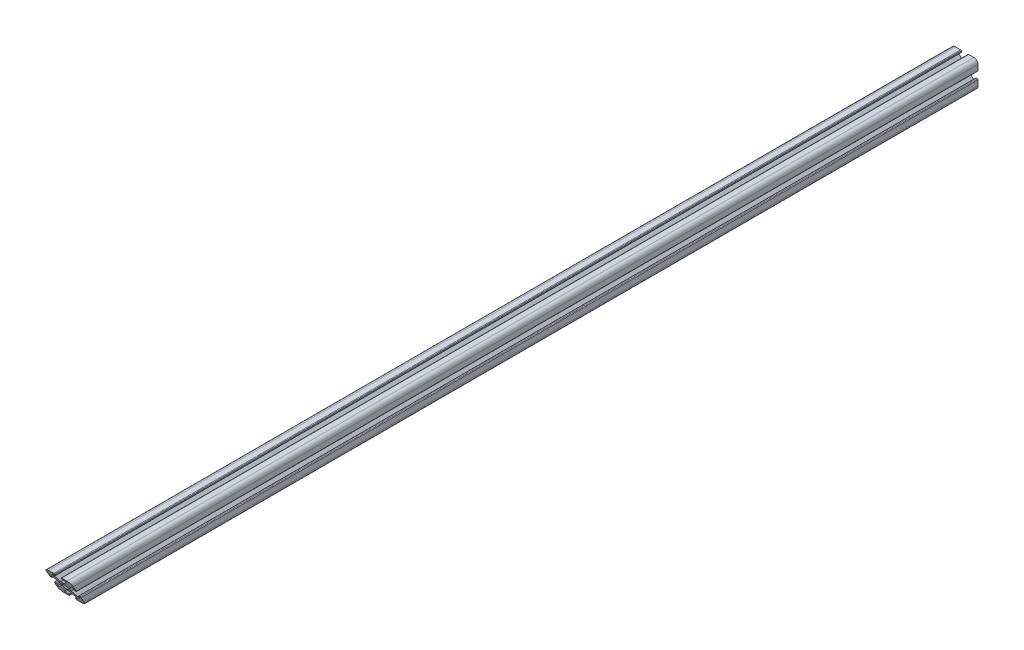
from build123d import *

# Parameters (mm, degrees)
SKETCH1_W           = 7.3
SKETCH1_H           = 7.3
SKETCH1_R           = 2.15
BOSS_EXTRUDE1_DEPTH = 680
BOSS_EXTRUDE2_DEPTH = 680
FILLET4_R           = 3
FILLET5_R           = 0.5
FILLET6_R           = 0.5
FILLET7_R           = 0.5
CUT_EXTRUDE1_DEPTH  = 681.147042925
CUT_EXTRUDE5_DEPTH  = 681.147042925
SKETCH5_R           = 2.15
CUT_EXTRUDE6_DEPTH  = 681.210498669
SKETCH6_R           = 2.15
CUT_EXTRUDE7_DEPTH  = 681.210498669
SKETCH9_R           = 2.15
CUT_EXTRUDE10_DEPTH = 681.210498669
SKETCH10_R          = 2.15
CUT_EXTRUDE11_DEPTH = 681.210498669
SKETCH13_R          = 2.15
CUT_EXTRUDE14_DEPTH = 681.210498669
SKETCH14_R          = 2.15
CUT_EXTRUDE15_DEPTH = 681.210498669


with BuildPart() as part:
    # Sketch1 → Boss-Extrude1 (new body)
    with BuildSketch(Plane.XY):
        Rectangle(SKETCH1_W, SKETCH1_H)
        Circle(SKETCH1_R, mode=Mode.SUBTRACT)
    extrude(amount=BOSS_EXTRUDE1_DEPTH)

    # Sketch2 → Boss-Extrude2 (add)
    with BuildSketch(Plane.XY):
        Polygon((3.65, 3.65), (1.2, 3.65), (5.750000001, 8.200000001), (2.500000001, 8.200000001), (2.500000001, 10.000000001), (10.000000001, 10.000000001), (10.000000001, 2.500000001), (8.200000001, 2.500000001), (8.200000001, 5.750000001), (3.65, 1.2), align=None)
        Polygon((-3.65, 3.65), (-1.2, 3.65), (-5.750000001, 8.200000001), (-2.500000001, 8.200000001), (-2.500000001, 10.000000001), (-10.000000001, 10.000000001), (-10.000000001, 2.500000001), (-8.200000001, 2.500000001), (-8.200000001, 5.750000001), (-3.65, 1.2), align=None)
        Polygon((-3.65, -3.65), (-3.65, -1.2), (-8.200000001, -5.750000001), (-8.200000001, -2.500000001), (-10.000000001, -2.500000001), (-10.000000001, -10.000000001), (-2.500000001, -10.000000001), (-2.500000001, -8.200000001), (-5.750000001, -8.200000001), (-1.2, -3.65), align=None)
        Polygon((3.65, -3.65), (3.65, -1.2), (8.200000001, -5.750000001), (8.200000001, -2.500000001), (10.000000001, -2.500000001), (10.000000001, -10.000000001), (2.500000001, -10.000000001), (2.500000001, -8.200000001), (5.750000001, -8.200000001), (1.2, -3.65), align=None)
    extrude(amount=BOSS_EXTRUDE2_DEPTH)

    # Fillet4
    fillet4_edges = [part.edges().sort_by_distance(p)[0] for p in [
        (10.000000001, 10.000000001, 340),
        (-10.000000001, 10.000000001, 340),
        (-10.000000001, -10.000000001, 340),
        (10.000000001, -10.000000001, 340),
    ]]
    fillet(fillet4_edges, radius=FILLET4_R)

    # Fillet5
    fillet5_edges = [part.edges().sort_by_distance(p)[0] for p in [
        (8.200000001, 2.500000001, 340),
        (10.000000001, 2.500000001, 340),
        (2.500000001, 10.000000001, 340),
        (2.500000001, 8.200000001, 340),
        (-2.500000001, 8.200000001, 340),
        (-2.500000001, 10.000000001, 340),
        (-10.000000001, 2.500000001, 340),
        (-8.200000001, 2.500000001, 340),
        (-8.200000001, -2.500000001, 340),
        (-10.000000001, -2.500000001, 340),
        (-2.500000001, -10.000000001, 340),
        (-2.500000001, -8.200000001, 340),
        (2.500000001, -8.200000001, 340),
        (10.000000001, -2.500000001, 340),
        (8.200000001, -2.500000001, 340),
    ]]
    fillet(fillet5_edges, radius=FILLET5_R)

    # Fillet6
    fillet6_edges = [part.edges().sort_by_distance(p)[0] for p in [
        (3.65, 1.2, 340),
        (1.2, 3.65, 340),
        (-3.65, 1.2, 340),
        (-1.2, 3.65, 340),
        (-1.2, -3.65, 340),
        (-3.65, -1.2, 340),
        (1.2, -3.65, 340),
        (3.65, -1.2, 340),
    ]]
    fillet(fillet6_edges, radius=FILLET6_R)

    # Fillet7
    fillet7_edges = [part.edges().sort_by_distance(p)[0] for p in [
        (8.200000001, 5.750000001, 340),
        (5.750000001, 8.200000001, 340),
        (-5.750000001, 8.200000001, 340),
        (-8.200000001, 5.750000001, 340),
        (-8.200000001, -5.750000001, 340),
        (-5.750000001, -8.200000001, 340),
        (5.750000001, -8.200000001, 340),
        (8.200000001, -5.750000001, 340),
    ]]
    fillet(fillet7_edges, radius=FILLET7_R)

    # Sketch3 → Cut-Extrude1 (cut, through all)
    with BuildSketch(Plane(origin=(0, 0, 0), x_dir=(0, 0, -1), z_dir=(1, 0, 0))):
        Polygon((-680, 10.000000001), (-680, -10.000000001), (-668.453, -10.000000001), align=None)
    extrude(amount=-CUT_EXTRUDE1_DEPTH, mode=Mode.SUBTRACT)

    # Sketch4 → Cut-Extrude5 (cut, through all)
    with BuildSketch(Plane(origin=(0, 0, 0), x_dir=(0, 0, -1), z_dir=(1, 0, 0))):
        Polygon((-680, 10.000000001), (-680, -10.000000001), (-668.453, -10.000000001), align=None)
    extrude(amount=CUT_EXTRUDE5_DEPTH, mode=Mode.SUBTRACT)

    # Sketch5 → Cut-Extrude6 (cut, through all)
    with BuildSketch(Plane.ZY.offset(3.65)):
        with Locations(Location((659.2265, 0, 0), (0, 0, 270))):
            Circle(SKETCH5_R)
    extrude(amount=-CUT_EXTRUDE6_DEPTH, mode=Mode.SUBTRACT)

    # Sketch6 → Cut-Extrude7 (cut, through all)
    with BuildSketch(Plane(origin=(3.65, 0, 0), x_dir=(0, 0, -1), z_dir=(1, 0, 0))):
        with Locations(Location((-659.2265, 0, 0), (0, 0, 270))):
            Circle(SKETCH6_R)
    extrude(amount=-CUT_EXTRUDE7_DEPTH, mode=Mode.SUBTRACT)

    # Sketch9 → Cut-Extrude10 (cut, through all)
    with BuildSketch(Plane(origin=(3.65, 0, 0), x_dir=(0, 0, -1), z_dir=(1, 0, 0))):
        with Locations(Location((-50.8, 0, 0), (0, 0, 90))):
            Circle(SKETCH9_R)
    extrude(amount=-CUT_EXTRUDE10_DEPTH, mode=Mode.SUBTRACT)

    # Sketch10 → Cut-Extrude11 (cut, through all)
    with BuildSketch(Plane.ZY.offset(3.65)):
        with Locations(Location((50.8, 0, 0), (0, 0, 90))):
            Circle(SKETCH10_R)
    extrude(amount=-CUT_EXTRUDE11_DEPTH, mode=Mode.SUBTRACT)

    # Sketch13 → Cut-Extrude14 (cut, through all)
    with BuildSketch(Plane(origin=(3.65, 0, 0), x_dir=(0, 0, -1), z_dir=(1, 0, 0))):
        with Locations(Location((-20, 0, 0), (0, 0, 90))):
            Circle(SKETCH13_R)
    extrude(amount=-CUT_EXTRUDE14_DEPTH, mode=Mode.SUBTRACT)

    # Sketch14 → Cut-Extrude15 (cut, through all)
    with BuildSketch(Plane.ZY.offset(3.65)):
        with Locations(Location((20, 0, 0), (0, 0, 90))):
            Circle(SKETCH14_R)
    extrude(amount=-CUT_EXTRUDE15_DEPTH, mode=Mode.SUBTRACT)


solid = part.part
